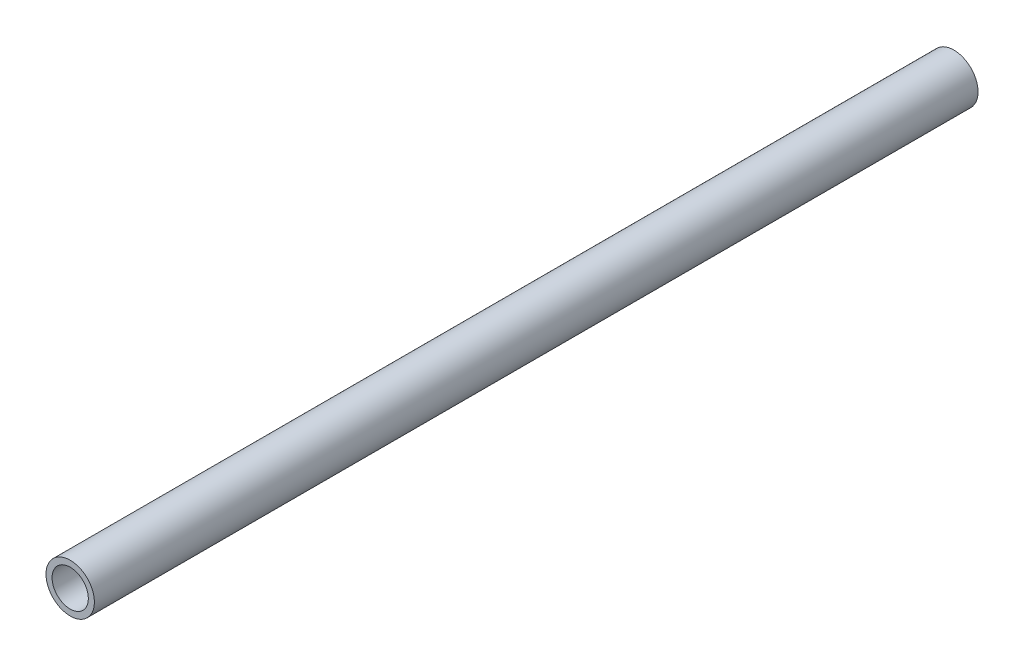
from build123d import *

# Parameters (mm, degrees)
SKETCH1_R           = 6.35
SKETCH1_R_2         = 4.7625
BOSS_EXTRUDE1_DEPTH = 232


with BuildPart() as part:
    # Sketch1 → Boss-Extrude1 (new body)
    with BuildSketch(Plane.XY):
        with Locations(Location((0, 0, 0), (0, 0, 180))):
            Circle(SKETCH1_R)
        with Locations(Location((0, 0, 0), (0, 0, 180))):
            Circle(SKETCH1_R_2, mode=Mode.SUBTRACT)
    extrude(amount=BOSS_EXTRUDE1_DEPTH)


solid = part.part
